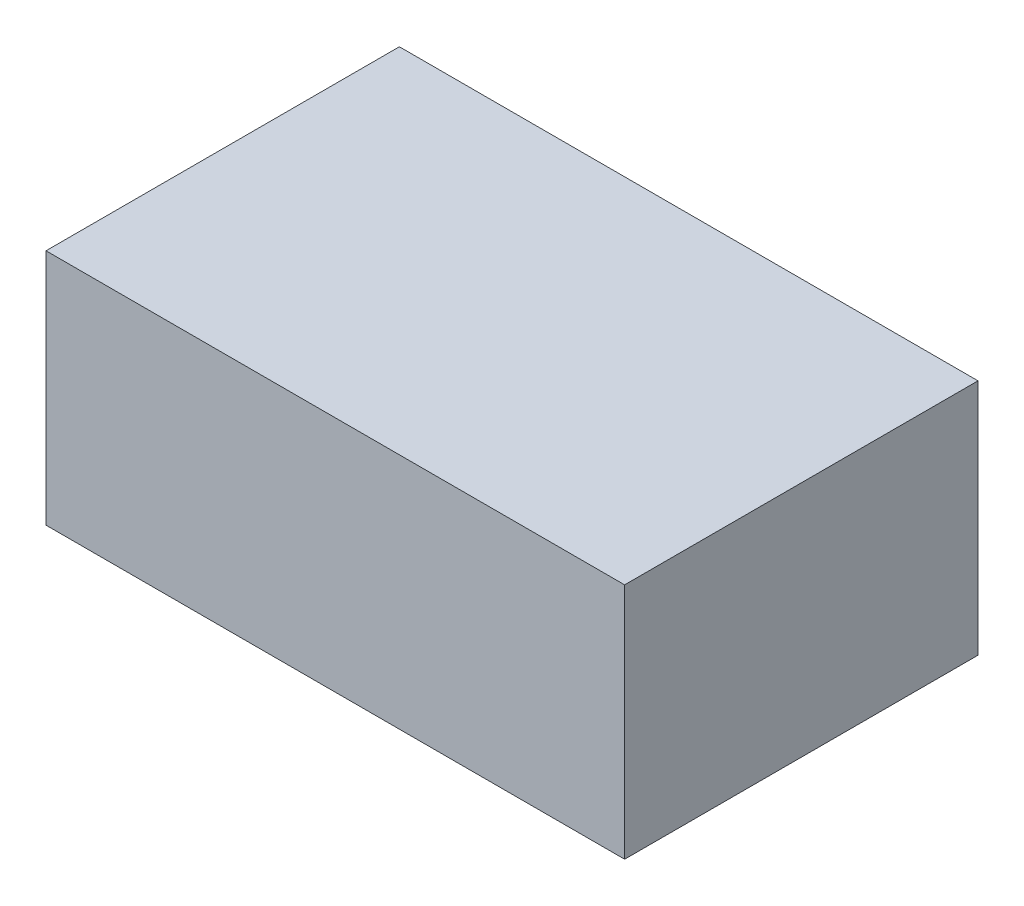
from build123d import *

# Parameters (mm, degrees)
SKETCH1_W           = 1.12
SKETCH1_H           = 0.46
BOSS_EXTRUDE1_DEPTH = 0.684


with BuildPart() as part:
    # Sketch1 → Boss-Extrude1 (new body)
    with BuildSketch(Plane.XY):
        with Locations((-0.61, -0.01)):
            Rectangle(SKETCH1_W, SKETCH1_H)
    extrude(amount=-BOSS_EXTRUDE1_DEPTH)


solid = part.part
